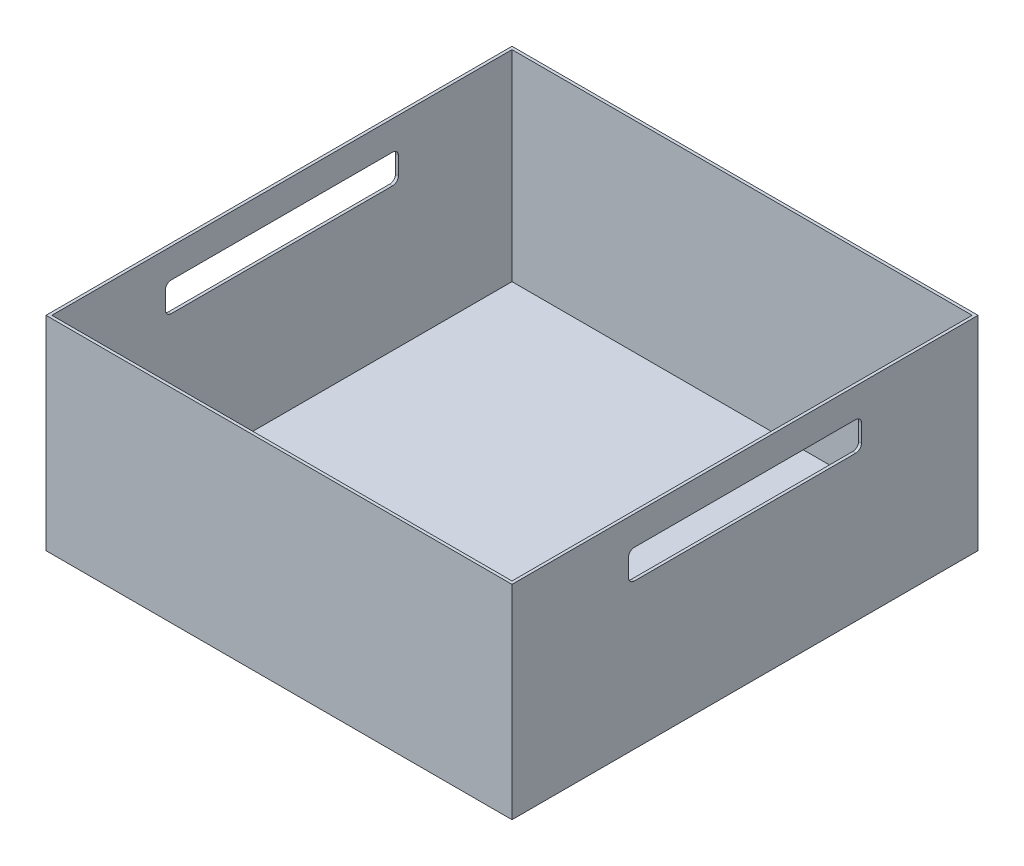
from build123d import *

# Parameters (mm, degrees)
SKIZZE1_W                            = 800
SKIZZE1_H                            = 800
AUFSATZ_LINEAR_AUSTRAGEN1_DEPTH      = 350
SKIZZE2_W                            = 790
SKIZZE2_H                            = 790
SCHNITT_LINEAR_AUSTRAGEN1_DEPTH      = 345
SCHNITT_LINEAR_AUSTRAGEN2_DEPTH      = 1185.271928233
SCHNITT_LINEAR_AUSTRAGEN2_DEPTH_BACK = 1185.271928233


with BuildPart() as part:
    # Skizze1 → Aufsatz-Linear austragen1 (new body)
    with BuildSketch(Plane(origin=(0, 0, 0), x_dir=(1, 0, 0), z_dir=(0, 1, 0))):
        with Locations((400, 400)):
            Rectangle(SKIZZE1_W, SKIZZE1_H)
    extrude(amount=AUFSATZ_LINEAR_AUSTRAGEN1_DEPTH)

    # Skizze2 → Schnitt-Linear austragen1 (cut)
    with BuildSketch(Plane(origin=(0, 350, 0), x_dir=(1, 0, 0), z_dir=(0, 1, 0))):
        with Locations((400, 400)):
            Rectangle(SKIZZE2_W, SKIZZE2_H)
    extrude(amount=-SCHNITT_LINEAR_AUSTRAGEN1_DEPTH, mode=Mode.SUBTRACT)

    # Skizze3 → Schnitt-Linear austragen2 (cut, two sides: drawn at the far end of the back side and taken through both)
    with BuildSketch(Plane(origin=(800, 0, 0), x_dir=(0, 0, -1), z_dir=(1, 0, 0)).offset(-SCHNITT_LINEAR_AUSTRAGEN2_DEPTH_BACK)):
        with BuildLine():
            Line((210, 300), (590, 300))
            ThreePointArc((590, 300), (597.071067812, 297.071067812), (600, 290))
            Line((600, 290), (600, 260))
            ThreePointArc((600, 260), (597.071067812, 252.928932188), (590, 250))
            Line((590, 250), (210, 250))
            ThreePointArc((210, 250), (202.928932188, 252.928932188), (200, 260))
            Line((200, 260), (200, 290))
            ThreePointArc((200, 290), (202.928932188, 297.071067812), (210, 300))
        make_face()
    extrude(amount=SCHNITT_LINEAR_AUSTRAGEN2_DEPTH + SCHNITT_LINEAR_AUSTRAGEN2_DEPTH_BACK, mode=Mode.SUBTRACT)


solid = part.part
